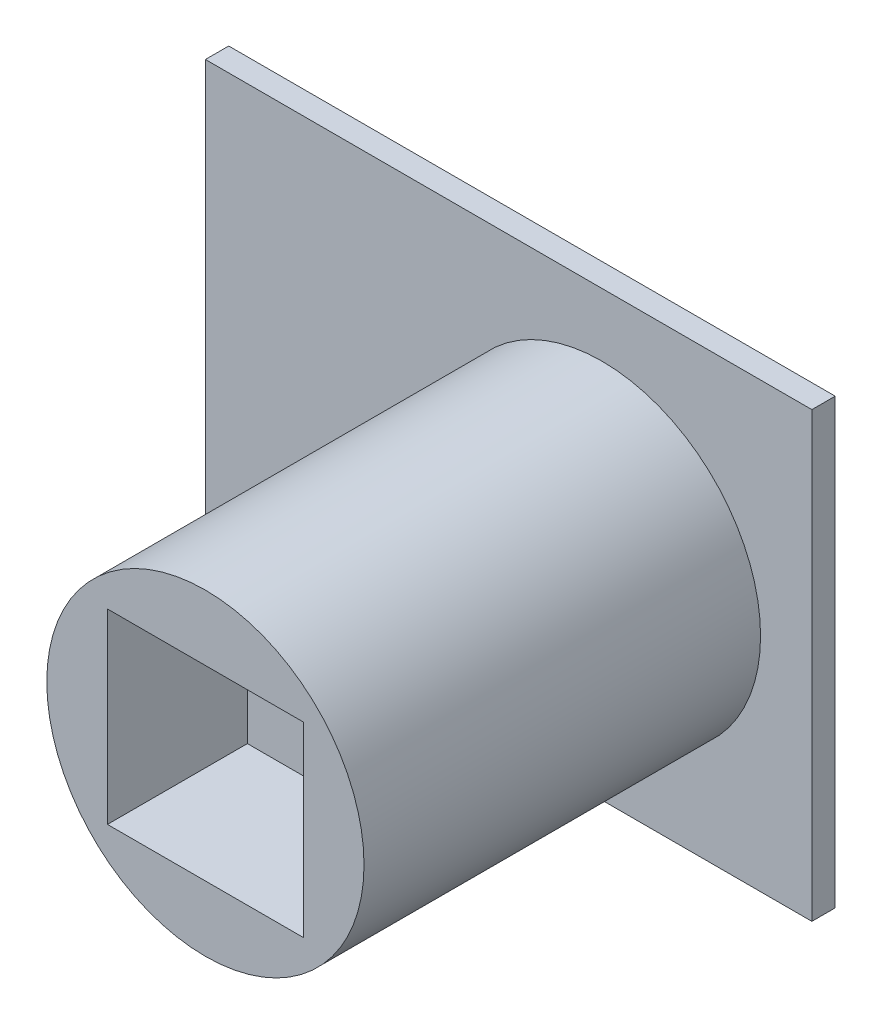
from build123d import *

# Parameters (mm, degrees)
CROQUIS1_W              = 130
CROQUIS1_H              = 95
SALIENTE_EXTRUIR1_DEPTH = 5
CROQUIS2_R              = 34
SALIENTE_EXTRUIR2_DEPTH = 85
CROQUIS3_W              = 42
CROQUIS3_H              = 40
CORTAR_EXTRUIR1_DEPTH   = 30


with BuildPart() as part:
    # Croquis1 → Saliente-Extruir1 (new body)
    with BuildSketch(Plane.XY):
        Rectangle(CROQUIS1_W, CROQUIS1_H)
    extrude(amount=SALIENTE_EXTRUIR1_DEPTH)

    # Croquis2 → Saliente-Extruir2 (add)
    with BuildSketch(Plane.XY.offset(5)):
        with Locations((20, 0)):
            Circle(CROQUIS2_R)
    extrude(amount=SALIENTE_EXTRUIR2_DEPTH)

    # Croquis3 → Cortar-Extruir1 (cut)
    with BuildSketch(Plane.XY.offset(90)):
        with Locations((20, 0)):
            Rectangle(CROQUIS3_W, CROQUIS3_H)
    extrude(amount=-CORTAR_EXTRUIR1_DEPTH, mode=Mode.SUBTRACT)


solid = part.part
